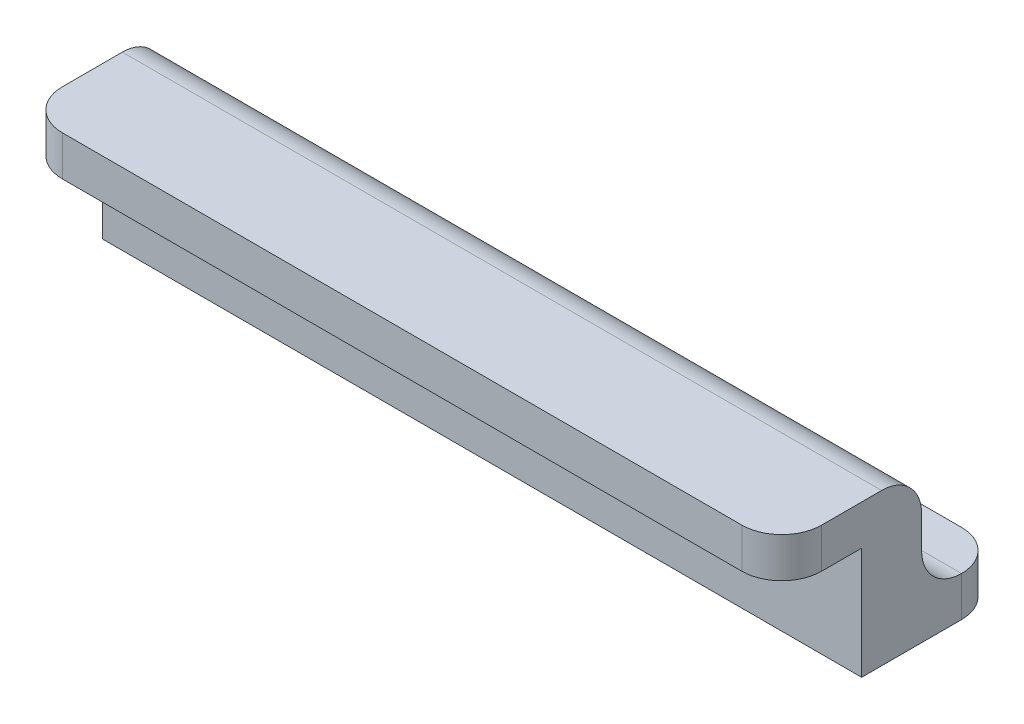
from build123d import *

# Parameters (mm, degrees)
BOSS_EXTRUDE1_DEPTH = 2
BOSS_EXTRUDE2_START = -7.6
BOSS_EXTRUDE2_DEPTH = 7.6
BOSS_EXTRUDE3_DEPTH = 2
SKETCH5_W           = 38
SKETCH5_H           = 5.8
CUT_EXTRUDE1_DEPTH  = 40.954474092
SKETCH6_W           = 38
SKETCH6_H           = 3
BOSS_EXTRUDE4_DEPTH = 7.6
FILLET1_R           = 2


with BuildPart() as part:
    # Sketch1 → Boss-Extrude1 (new body)
    with BuildSketch(Plane(origin=(0, 0, 0), x_dir=(1, 0, 0), z_dir=(0, 1, 0))):
        with BuildLine():
            Line((2, 0), (36, 0))
            ThreePointArc((36, 0), (37.414213562, 0.585786438), (38, 2))
            Line((38, 2), (38, 6))
            ThreePointArc((38, 6), (37.707106781, 6.707106781), (37, 7))
            Line((37, 7), (1, 7))
            ThreePointArc((1, 7), (0.292893219, 6.707106781), (0, 6))
            Line((0, 6), (0, 2))
            ThreePointArc((0, 2), (0.585786438, 0.585786438), (2, 0))
        make_face()
    extrude(amount=BOSS_EXTRUDE1_DEPTH)

    # Sketch2 → Boss-Extrude2 (add)
    with BuildSketch(Plane(origin=(0, 2, 0), x_dir=(1, 0, 0), z_dir=(0, 1, 0)).offset(BOSS_EXTRUDE2_START)):
        with BuildLine():
            Line((38, 6), (38, 2))
            ThreePointArc((38, 2), (37.788854382, 1.105572809), (37.2, 0.4))
            Line((37.2, 0.4), (37.2, 5.3))
            ThreePointArc((37.2, 5.3), (37.053553391, 5.653553391), (36.7, 5.8))
            Line((36.7, 5.8), (1.3, 5.8))
            ThreePointArc((1.3, 5.8), (0.946446609, 5.653553391), (0.8, 5.3))
            Line((0.8, 5.3), (0.8, 0.4))
            ThreePointArc((0.8, 0.4), (0.211145618, 1.105572809), (0, 2))
            Line((0, 2), (0, 6))
            ThreePointArc((0, 6), (0.292893219, 6.707106781), (1, 7))
            Line((1, 7), (37, 7))
            ThreePointArc((37, 7), (37.707106781, 6.707106781), (38, 6))
        make_face()
    extrude(amount=BOSS_EXTRUDE2_DEPTH)

    # Sketch4 → Boss-Extrude3 (add)
    with BuildSketch(Plane.XZ.offset(5.6)):
        with BuildLine():
            Line((37, -7), (1, -7))
            ThreePointArc((1, -7), (0.292893219, -6.707106781), (0, -6))
            Line((0, -6), (0, -9))
            ThreePointArc((0, -9), (0.585786438, -10.414213562), (2, -11))
            Line((2, -11), (36, -11))
            ThreePointArc((36, -11), (37.414213562, -10.414213562), (38, -9))
            Line((38, -9), (38, -6))
            ThreePointArc((38, -6), (37.707106781, -6.707106781), (37, -7))
        make_face()
    extrude(amount=-BOSS_EXTRUDE3_DEPTH)

    # Sketch5 → Cut-Extrude1 (cut, through all)
    with BuildSketch(Plane.XZ):
        with Locations((19, -2.9)):
            Rectangle(SKETCH5_W, SKETCH5_H)
    extrude(amount=CUT_EXTRUDE1_DEPTH, mode=Mode.SUBTRACT)

    # Sketch6 → Boss-Extrude4 (add)
    with BuildSketch(Plane.XZ.offset(5.6)):
        with Locations((19, -5.5)):
            Rectangle(SKETCH6_W, SKETCH6_H)
    extrude(amount=-BOSS_EXTRUDE4_DEPTH)

    # Fillet1
    fillet1_edges = [part.edges().sort_by_distance(p)[0] for p in [
        (19, 2, -7),
        (19, -3.6, -7),
    ]]
    fillet(fillet1_edges, radius=FILLET1_R)


solid = part.part
